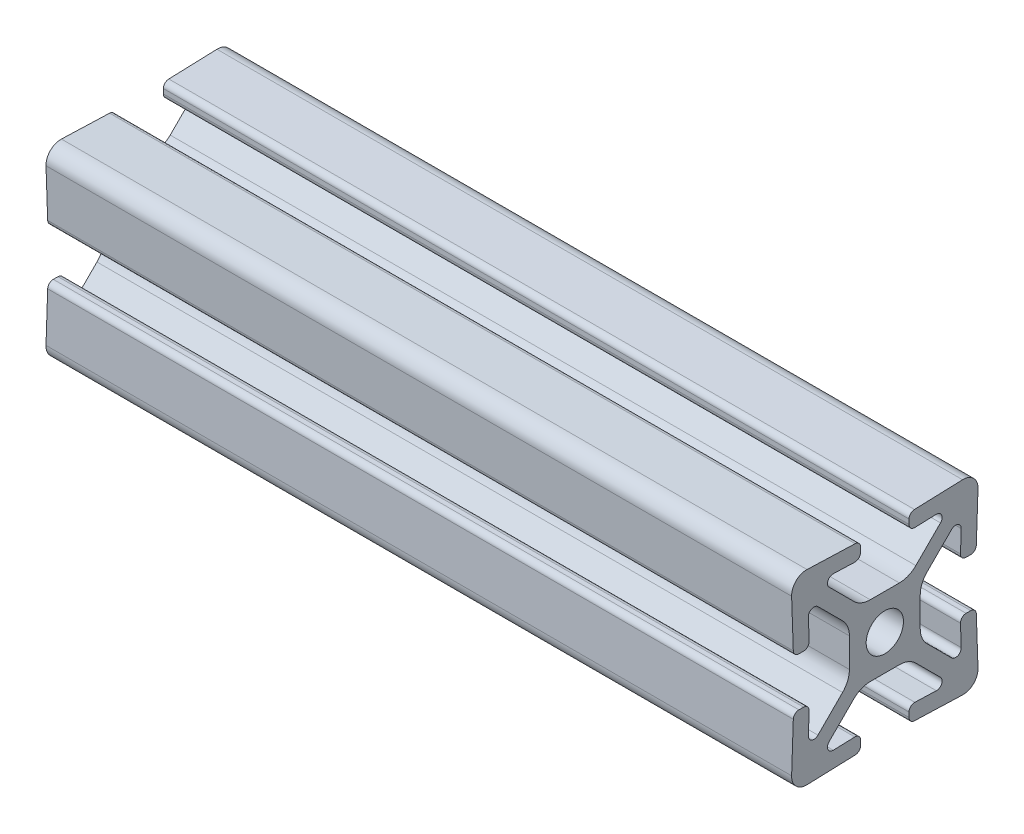
from build123d import *

# Parameters (mm, degrees)
BOSS_EXTRUDE1_DEPTH      = 50.8
BOSS_EXTRUDE1_DEPTH_BACK = 50.8


with BuildPart() as part:
    # Sketch3 → Boss-Extrude1 (new, two sides: drawn at the far end of the back side and taken through both)
    with BuildSketch(Plane(origin=(0, 0, 0), x_dir=(0, 0, -1), z_dir=(1, 0, 0)).offset(-BOSS_EXTRUDE1_DEPTH_BACK)):
        with BuildLine():
            Line((0, 4.826), (1.984228399, 4.826))
            ThreePointArc((1.984228399, 4.826), (3.199248297, 5.067682484), (4.229292429, 5.75593597))
            Line((4.229292429, 5.75593597), (7.586577723, 9.113221264))
            ThreePointArc((7.586577723, 9.113221264), (7.746562132, 9.955883421), (7.021168939, 10.413572441))
            Line((7.021168939, 10.413572441), (4.090593416, 10.311234489))
            ThreePointArc((4.090593416, 10.311234489), (3.534670322, 10.524633371), (3.302, 11.072770299))
            Line((3.302, 11.072770299), (3.302, 11.70815736))
            ThreePointArc((3.302, 11.70815736), (3.515863072, 12.237487038), (4.037406584, 12.46969317))
            Line((4.037406584, 12.46969317), (10.597084223, 12.698762161))
            ThreePointArc((10.597084223, 12.698762161), (12.104840979, 12.104840979), (12.698762161, 10.597084223))
            Line((12.698762161, 10.597084223), (12.46969317, 4.037406584))
            ThreePointArc((12.46969317, 4.037406584), (12.237487038, 3.515863072), (11.70815736, 3.302))
            Line((11.70815736, 3.302), (11.072770299, 3.302))
            ThreePointArc((11.072770299, 3.302), (10.524633371, 3.534670322), (10.311234489, 4.090593416))
            Line((10.311234489, 4.090593416), (10.413572441, 7.021168939))
            ThreePointArc((10.413572441, 7.021168939), (9.955883421, 7.746562132), (9.113221264, 7.586577723))
            Line((9.113221264, 7.586577723), (5.75593597, 4.229292429))
            ThreePointArc((5.75593597, 4.229292429), (5.067682484, 3.199248297), (4.826, 1.984228399))
            Line((4.826, 1.984228399), (4.826, 0))
            Line((4.826, 0), (2.54, 0))
            ThreePointArc((2.54, 0), (1.796051224, 1.796051224), (0, 2.54))
            Line((0, 2.54), (0, 4.826))
        make_face()
    extrude(amount=BOSS_EXTRUDE1_DEPTH + BOSS_EXTRUDE1_DEPTH_BACK)

    # Mirror1: part across plane


with BuildPart() as part_1:
    add(part.part)
    add(part.part.mirror(Plane.ZX))

    # Mirror2: part across plane


with BuildPart() as part_2:
    add(part_1.part)
    add(part_1.part.mirror(Plane.XY))


solid = part_2.part
